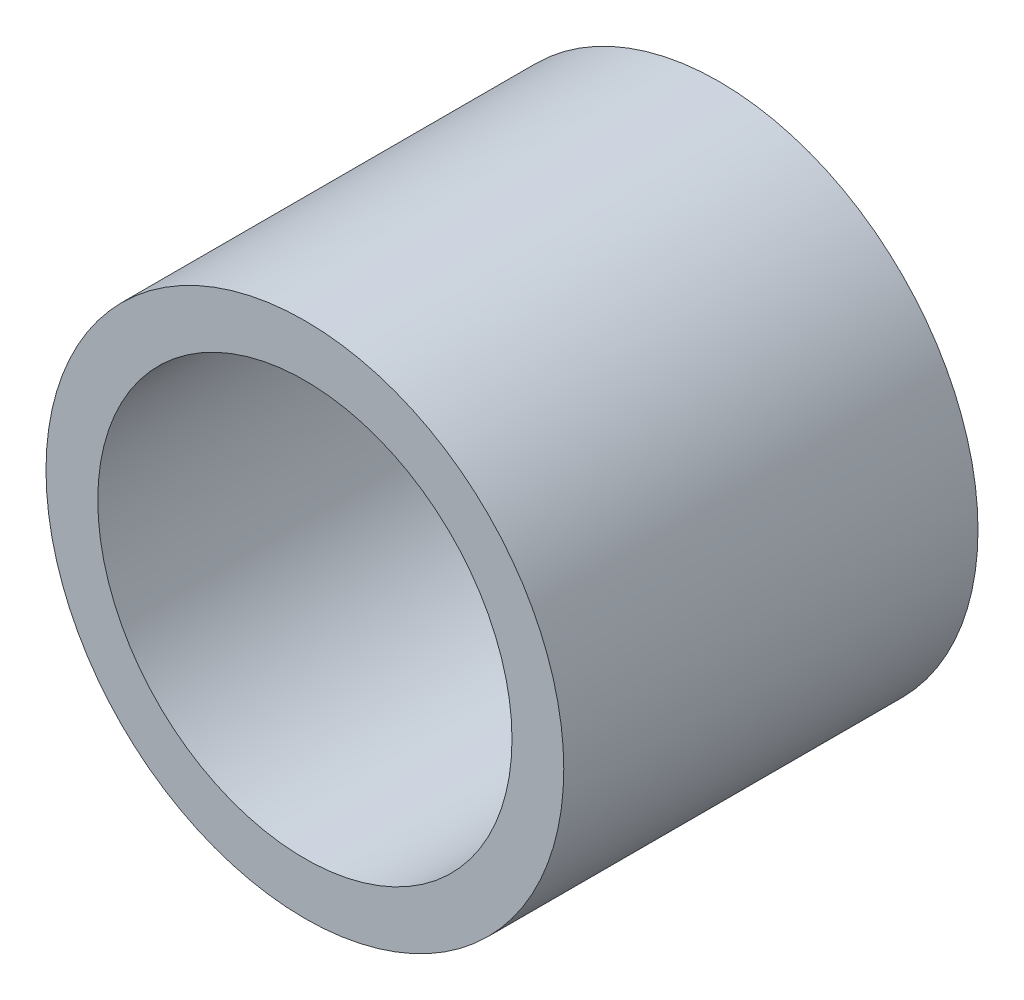
from build123d import *

# Parameters (mm, degrees)
ESQUISSE1_R      = 7.5
ESQUISSE1_R_2    = 6
EXTRUSION1_DEPTH = 12


with BuildPart() as part:
    # Esquisse1 → Extrusion1 (new body)
    with BuildSketch(Plane.XY):
        with Locations((0, 63.671361037)):
            Circle(ESQUISSE1_R)
        with Locations((0, 63.671361037)):
            Circle(ESQUISSE1_R_2, mode=Mode.SUBTRACT)
    extrude(amount=EXTRUSION1_DEPTH)


solid = part.part
